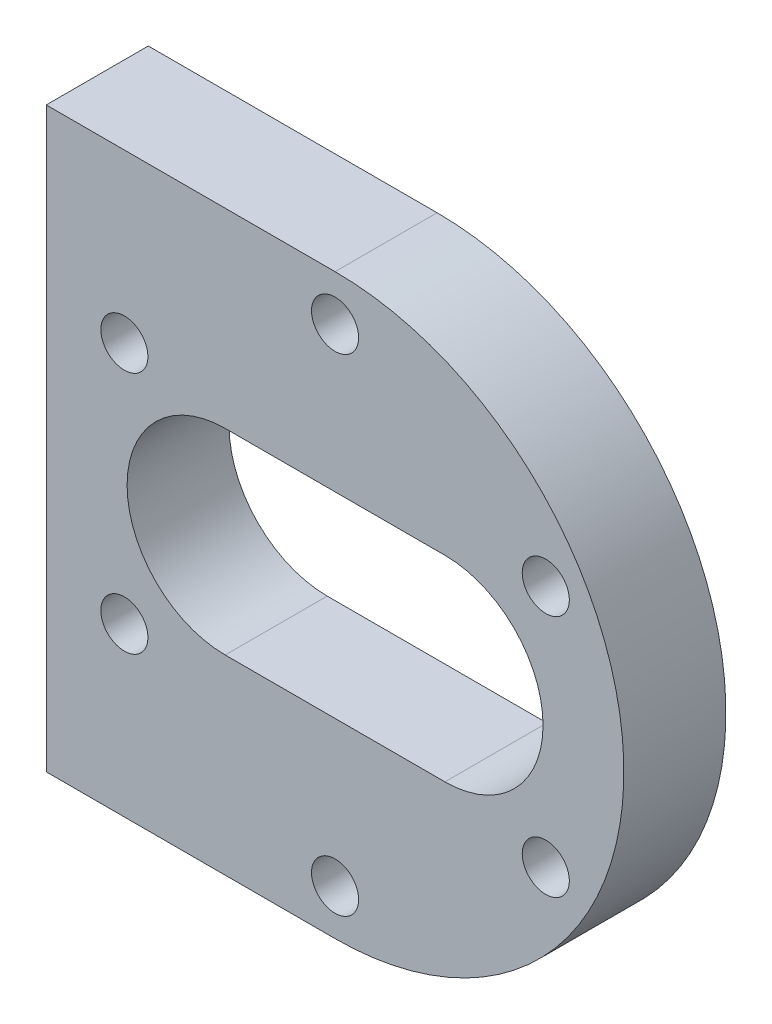
from build123d import *

# Parameters (mm, degrees)
SKETCH_1_R      = 1.5
EXTRUDE_1_DEPTH = 6.5


with BuildPart() as part:
    # 草图1 → 凸台-拉伸1 (new body)
    with BuildSketch(Plane.XY):
        with BuildLine():
            Line((0.819984335, 16.536837123), (-17.580015665, 16.536837123))
            Line((-17.580015665, 16.536837123), (-17.580015665, -20.263162877))
            Line((-17.580015665, -20.263162877), (0.819984335, -20.263162877))
            ThreePointArc((0.819984335, -20.263162877), (19.219984335, -1.863162877), (0.819984335, 16.536837123))
        make_face()
        with Locations((-12.603409424, -9.613162877)):
            Circle(SKETCH_1_R, mode=Mode.SUBTRACT)
        with Locations((0.819984335, -17.363162877)):
            Circle(SKETCH_1_R, mode=Mode.SUBTRACT)
        with Locations((14.243378094, -9.613162877)):
            Circle(SKETCH_1_R, mode=Mode.SUBTRACT)
        with Locations((-12.603409424, 5.886837123)):
            Circle(SKETCH_1_R, mode=Mode.SUBTRACT)
        with BuildLine():
            ThreePointArc((7.819984335, 4.386837123), (14.069984335, -1.863162877), (7.819984335, -8.113162877))
            Line((7.819984335, -8.113162877), (-6.180015665, -8.113162877))
            ThreePointArc((-6.180015665, -8.113162877), (-12.430015665, -1.863162877), (-6.180015665, 4.386837123))
            Line((-6.180015665, 4.386837123), (7.819984335, 4.386837123))
        make_face(mode=Mode.SUBTRACT)
        with Locations((14.243378094, 5.886837123)):
            Circle(SKETCH_1_R, mode=Mode.SUBTRACT)
        with Locations((0.819984335, 13.636837123)):
            Circle(SKETCH_1_R, mode=Mode.SUBTRACT)
    extrude(amount=EXTRUDE_1_DEPTH)


solid = part.part
